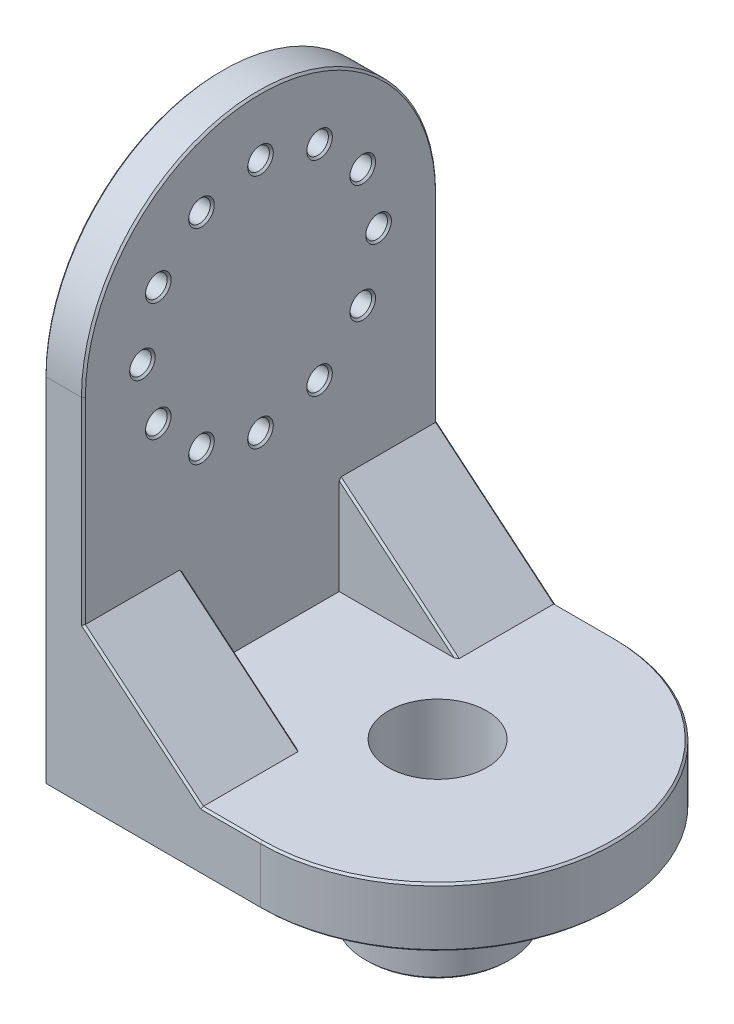
from build123d import *

# Parameters (mm, degrees)
SKETCH_1_R          = 45
EXTRUDE_1_DEPTH     = 10
SKETCH_2_R          = 2.75
CUT_EXTRUDE_1_DEPTH = 65.420493634
EXTRUDE_START       = -5
EXTRUDE_2_DEPTH     = 5
EXTRUDE_3_DEPTH     = 5
EXTRUDE_START_2     = 10
EXTRUDE_4_DEPTH     = 10
SKETCH_6_R          = 18.25
EXTRUDE_5_DEPTH     = 25
EXTRUDE_6_DEPTH     = 25
EXTRUDE_7_DEPTH     = 25
EXTRUDE_START_3     = 5
EXTRUDE_8_DEPTH     = 5
CHAMFER_1_SIZE      = 0.5
CHAMFER_2_SIZE      = 0.5
CHAMFER_3_SIZE      = 0.5
CHAMFER_4_SIZE      = 0.5
CHAMFER_5_SIZE      = 0.5
SKETCH_10_R         = 12.5
CUT_EXTRUDE_2_DEPTH = 194.971647413


with BuildPart() as part:
    # 草图1 → 凸台-拉伸1 (new body)
    with BuildSketch(Plane(origin=(0, 0, 0), x_dir=(0, 0, -1), z_dir=(1, 0, 0))):
        Circle(SKETCH_1_R)
    extrude(amount=EXTRUDE_1_DEPTH)

    # 草图2 → 切除-拉伸1 (cut, through all)
    with BuildSketch(Plane(origin=(10, 0, 0), x_dir=(0, 0, -1), z_dir=(1, 0, 0))):
        with Locations((0, 30)):
            Circle(SKETCH_2_R)
        with Locations((30, 0)):
            Circle(SKETCH_2_R)
        with Locations((0, -30)):
            Circle(SKETCH_2_R)
        with Locations((-30, 0)):
            Circle(SKETCH_2_R)
        with Locations((25.980762114, 15)):
            Circle(SKETCH_2_R)
        with Locations((15, 25.980762114)):
            Circle(SKETCH_2_R)
        with Locations(Location((-15, 25.980762114, 0), (0, 0, 180))):
            Circle(SKETCH_2_R)
        with Locations(Location((-25.980762114, 15, 0), (0, 0, 180))):
            Circle(SKETCH_2_R)
        with Locations((-25.980762114, -15)):
            Circle(SKETCH_2_R)
        with Locations((-15, -25.980762114)):
            Circle(SKETCH_2_R)
        with Locations(Location((15, -25.980762114, 0), (0, 0, 180))):
            Circle(SKETCH_2_R)
        with Locations(Location((25.980762114, -15, 0), (0, 0, 180))):
            Circle(SKETCH_2_R)
    extrude(amount=-CUT_EXTRUDE_1_DEPTH, mode=Mode.SUBTRACT)

    # 草图3 → 凸台-拉伸2 (add)
    with BuildSketch(Plane(origin=(10, 0, 0), x_dir=(0, 0, -1), z_dir=(1, 0, 0)).offset(EXTRUDE_START)):
        with BuildLine():
            ThreePointArc((45, 0), (0, -45), (-45, 0))
            Line((-45, 0), (-45, -80))
            Line((-45, -80), (45, -80))
            Line((45, -80), (45, 0))
        make_face()
    extrude(amount=EXTRUDE_2_DEPTH)

    # 草图4 → 凸台-拉伸3 (add)
    with BuildSketch(Plane.XZ.offset(80)):
        with BuildLine():
            Line((10, 45), (55, 45))
            ThreePointArc((55, 45), (100, 0), (55, -45))
            Line((55, -45), (10, -45))
            Line((10, -45), (10, 45))
        make_face()
    extrude(amount=-EXTRUDE_3_DEPTH)

    # 草图5 → 凸台-拉伸4 (add)
    with BuildSketch(Plane.XZ.offset(80).offset(EXTRUDE_START_2)):
        with BuildLine():
            Line((5, -45), (55, -45))
            ThreePointArc((55, -45), (100, 0), (55, 45))
            Line((55, 45), (5, 45))
            Line((5, 45), (5, -45))
        make_face()
    extrude(amount=-EXTRUDE_4_DEPTH)

    # 草图6 → 凸台-拉伸5 (add)
    with BuildSketch(Plane.XZ.offset(90)):
        with Locations(Location((55, 0, 0), (0, 0, 270))):
            Circle(SKETCH_6_R)
    extrude(amount=EXTRUDE_5_DEPTH)

    # 草图7 → 凸台-拉伸6 (add)
    with BuildSketch(Plane(origin=(0, 0, -45), x_dir=(-1, 0, 0), z_dir=(0, 0, -1))):
        Polygon((-40, -75), (-10, -50), (-10, -75), align=None)
    extrude(amount=-EXTRUDE_6_DEPTH)

    # 草图8 → 凸台-拉伸7 (add)
    with BuildSketch(Plane.XY.offset(45)):
        Polygon((10, -75), (40, -75), (10, -50), align=None)
    extrude(amount=-EXTRUDE_7_DEPTH)

    # 草图9 → 凸台-拉伸8 (add)
    with BuildSketch(Plane.ZY.offset(-5).offset(EXTRUDE_START_3)):
        with BuildLine():
            Line((-45, 0), (-45, -90))
            Line((-45, -90), (45, -90))
            Line((45, -90), (45, 0))
            ThreePointArc((45, 0), (0, -45), (-45, 0))
        make_face()
    extrude(amount=-EXTRUDE_8_DEPTH)

    # 倒角1
    chamfer_1_edges = [part.edges().sort_by_distance(p)[0] for p in [
        (55, -115, 18.25),
    ]]
    chamfer(chamfer_1_edges, length=CHAMFER_1_SIZE)

    # 倒角2
    chamfer_2_edges = [part.edges().sort_by_distance(p)[0] for p in [
        (10, -15, 28.730762114),
        (10, 15, 23.230762114),
        (10, 25.980762114, 12.25),
        (10, 25.980762114, -12.25),
        (10, 0, -27.25),
        (10, -30, 2.75),
        (10, 0, 32.75),
        (10, 15, -23.230762114),
        (10, -25.980762114, 17.75),
        (10, -25.980762114, -17.75),
        (10, -15, -28.730762114),
        (10, 30, 2.75),
    ]]
    chamfer(chamfer_2_edges, length=CHAMFER_2_SIZE)

    # 倒角3
    chamfer_3_edges = [part.edges().sort_by_distance(p)[0] for p in [
        (0, -45, -45),
        (0, -90, 0),
        (0, -45, 45),
        (0, 45, 0),
        (0, -15, 28.730762114),
        (0, 15, 23.230762114),
        (0, 25.980762114, 12.25),
        (0, 25.980762114, -12.25),
        (0, 0, -27.25),
        (0, -30, 2.75),
        (0, 0, 32.75),
        (0, 15, -23.230762114),
        (0, -25.980762114, 17.75),
        (0, -25.980762114, -17.75),
        (0, -15, -28.730762114),
        (0, 30, 2.75),
    ]]
    chamfer(chamfer_3_edges, length=CHAMFER_3_SIZE)

    # 倒角4
    chamfer_4_edges = [part.edges().sort_by_distance(p)[0] for p in [
        (10, -25, -45),
        (10, 45, 0),
        (10, -25, 45),
    ]]
    chamfer(chamfer_4_edges, length=CHAMFER_4_SIZE)

    # 倒角5
    chamfer_5_edges = [part.edges().sort_by_distance(p)[0] for p in [
        (25, -62.5, 20),
        (25, -62.5, -20),
        (24.75, -62.291666667, -45),
        (27.75, -90, -45),
        (27.75, -90, 45),
        (100, -90, 0),
        (100, -75, 0),
        (47.5, -75, -45),
        (47.5, -75, 45),
        (24.75, -62.291666667, 45),
    ]]
    chamfer(chamfer_5_edges, length=CHAMFER_5_SIZE)

    # 草图10 → 切除-拉伸2 (cut, through all)
    with BuildSketch(Plane.XZ.offset(115)):
        with Locations(Location((55, 0, 0), (0, 0, 270))):
            Circle(SKETCH_10_R)
    extrude(amount=-CUT_EXTRUDE_2_DEPTH, mode=Mode.SUBTRACT)


solid = part.part
